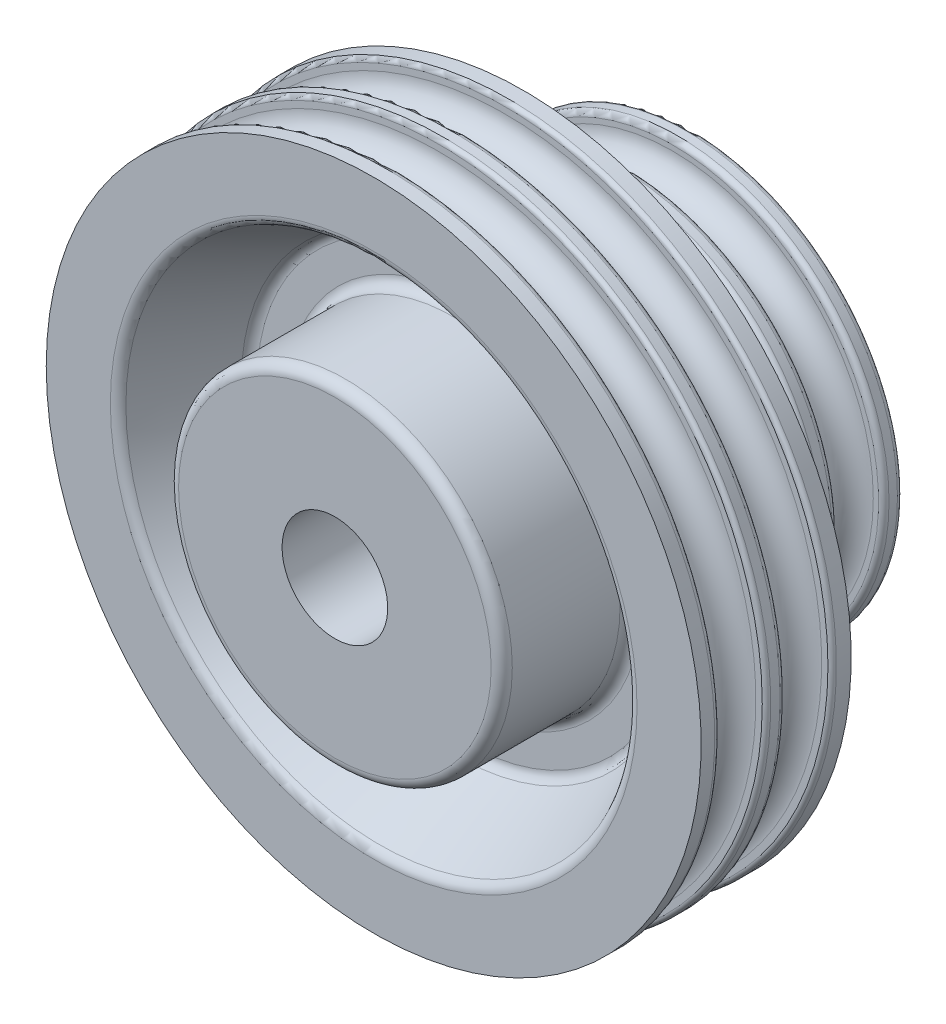
from build123d import *

# Parameters (mm, degrees)
BOSS_EXTRUDE1_START = -34
SKETCH2_R           = 11
BOSS_EXTRUDE1_DEPTH = 34
SKETCH3_R           = 5
CUT_EXTRUDE1_DEPTH  = 43


with BuildPart() as part:
    # Sketch1 → Revolve1 (revolve)
    with BuildSketch(Plane(origin=(0, 0, 0), x_dir=(1, 0, 0), z_dir=(0, 1, 0)), mode=Mode.PRIVATE) as revolve1_sk:
        with BuildLine():
            Line((-38.251280268, -2.950412804), (-44.321795805, -2.950412804))
            ThreePointArc((-44.321795805, -2.950412804), (-44.855139809, -2.796311245), (-45.224105529, -2.38150115))
            Line((-45.224105529, -2.38150115), (-48.756126213, 5.011360754))
            ThreePointArc((-48.756126213, 5.011360754), (-49.125091933, 5.426170849), (-49.658435937, 5.580272408))
            Line((-49.658435937, 5.580272408), (-52.455128445, 5.580272408))
            ThreePointArc((-52.455128445, 5.580272408), (-53.162235226, 5.287379189), (-53.455128445, 4.580272408))
            Line((-53.455128445, 4.580272408), (-53.455128445, -5.625326394))
            ThreePointArc((-53.455128445, -5.625326394), (-53.748021664, -6.332433175), (-54.455128445, -6.625326394))
            Line((-54.455128445, -6.625326394), (-58.251280268, -6.625326394))
            Line((-58.251280268, -6.625326394), (-58.251280268, -0.625326394))
            Line((-58.251280268, -0.625326394), (-59.251280268, -0.625326394))
            Line((-59.251280268, -0.625326394), (-59.251280268, 21.143765287))
            Line((-59.251280268, 21.143765287), (-58.251280268, 21.143765287))
            Line((-58.251280268, 21.143765287), (-58.251280268, 27.143765287))
            Line((-58.251280268, 27.143765287), (-49.751197565, 27.143765287))
            ThreePointArc((-49.751197565, 27.143765287), (-49.39475876, 26.99439418), (-49.251280268, 26.635542858))
            Line((-49.251280268, 26.635542858), (-49.251280268, 25.835788958))
            ThreePointArc((-49.251280268, 25.835788958), (-49.400494647, 25.487402996), (-49.751216642, 25.343765287))
            Line((-49.751216642, 25.343765287), (-50.251280268, 25.343765287))
            ThreePointArc((-50.251280268, 25.343765287), (-52.451280268, 23.143765287), (-50.251280268, 20.943765287))
            Line((-50.251280268, 20.943765287), (-49.751280268, 20.943765287))
            ThreePointArc((-49.751280268, 20.943765287), (-49.397726877, 20.797318677), (-49.251280268, 20.443765287))
            Line((-49.251280268, 20.443765287), (-49.251280268, 19.645715787))
            ThreePointArc((-49.251280268, 19.645715787), (-49.397726877, 19.292162396), (-49.751280268, 19.145715787))
            Line((-49.751280268, 19.145715787), (-50.335053739, 19.145715787))
            ThreePointArc((-50.335053739, 19.145715787), (-52.658972595, 17.077044438), (-50.590301246, 14.753125581))
            Line((-50.590301246, 14.753125581), (-49.751280268, 14.753125581))
            ThreePointArc((-49.751280268, 14.753125581), (-49.397726877, 14.606678972), (-49.251280268, 14.253125581))
            Line((-49.251280268, 14.253125581), (-49.251280268, 11.863404309))
            Line((-49.251280268, 11.863404309), (-49.251280268, 11.753125581))
            ThreePointArc((-49.251280268, 11.753125581), (-49.104833658, 11.399572191), (-48.751280268, 11.253125581))
            Line((-48.751280268, 11.253125581), (-45.790301246, 11.253125581))
            Line((-45.790301246, 11.253125581), (-45.089795177, 11.253125581))
            Line((-45.089795177, 11.253125581), (-38.251280268, 11.253125581))
            Line((-38.251280268, 11.253125581), (-38.251280268, 9.853125581))
            ThreePointArc((-38.251280268, 9.853125581), (-38.368437555, 9.570282869), (-38.651280268, 9.453125581))
            Line((-38.651280268, 9.453125581), (-39.251280268, 9.453125581))
            ThreePointArc((-39.251280268, 9.453125581), (-41.469753514, 7.234652335), (-39.251280268, 5.016179088))
            Line((-39.251280268, 5.016179088), (-38.751280268, 5.016179088))
            ThreePointArc((-38.751280268, 5.016179088), (-38.397726877, 4.869732479), (-38.251280268, 4.516179088))
            Line((-38.251280268, 4.516179088), (-38.251280268, 3.634652335))
            ThreePointArc((-38.251280268, 3.634652335), (-38.368437555, 3.351809622), (-38.651280268, 3.234652335))
            Line((-38.651280268, 3.234652335), (-39.251280268, 3.234652335))
            ThreePointArc((-39.251280268, 3.234652335), (-41.451280268, 1.034652335), (-39.251280268, -1.165347665))
            Line((-39.251280268, -1.165347665), (-38.651280268, -1.165347665))
            ThreePointArc((-38.651280268, -1.165347665), (-38.361033132, -1.342575878), (-38.251280268, -1.664457142))
            Line((-38.251280268, -1.664457142), (-38.251280268, -2.895977648))
            Line((-38.251280268, -2.895977648), (-38.251280268, -2.950412804))
        make_face()
    revolve(revolve1_sk.sketch.rotate(Axis((-69.251280268, 0, -55.278342432), (0, 0, 1)), 180), axis=Axis((-69.251280268, 0, -55.278342432), (0, 0, 1)))

    # Sketch2 → Boss-Extrude1 (add)
    with BuildSketch(Plane.XY.offset(6.625326394).offset(BOSS_EXTRUDE1_START)):
        with Locations((-69.251280268, 0)):
            Circle(SKETCH2_R)
    extrude(amount=BOSS_EXTRUDE1_DEPTH)

    # Sketch3 → Cut-Extrude1 (cut)
    with BuildSketch(Plane(origin=(0, 0, -27.374673606), x_dir=(-1, 0, 0), z_dir=(0, 0, -1))):
        with Locations((69.251280268, 0)):
            Circle(SKETCH3_R)
    extrude(amount=-CUT_EXTRUDE1_DEPTH, mode=Mode.SUBTRACT)


solid = part.part
